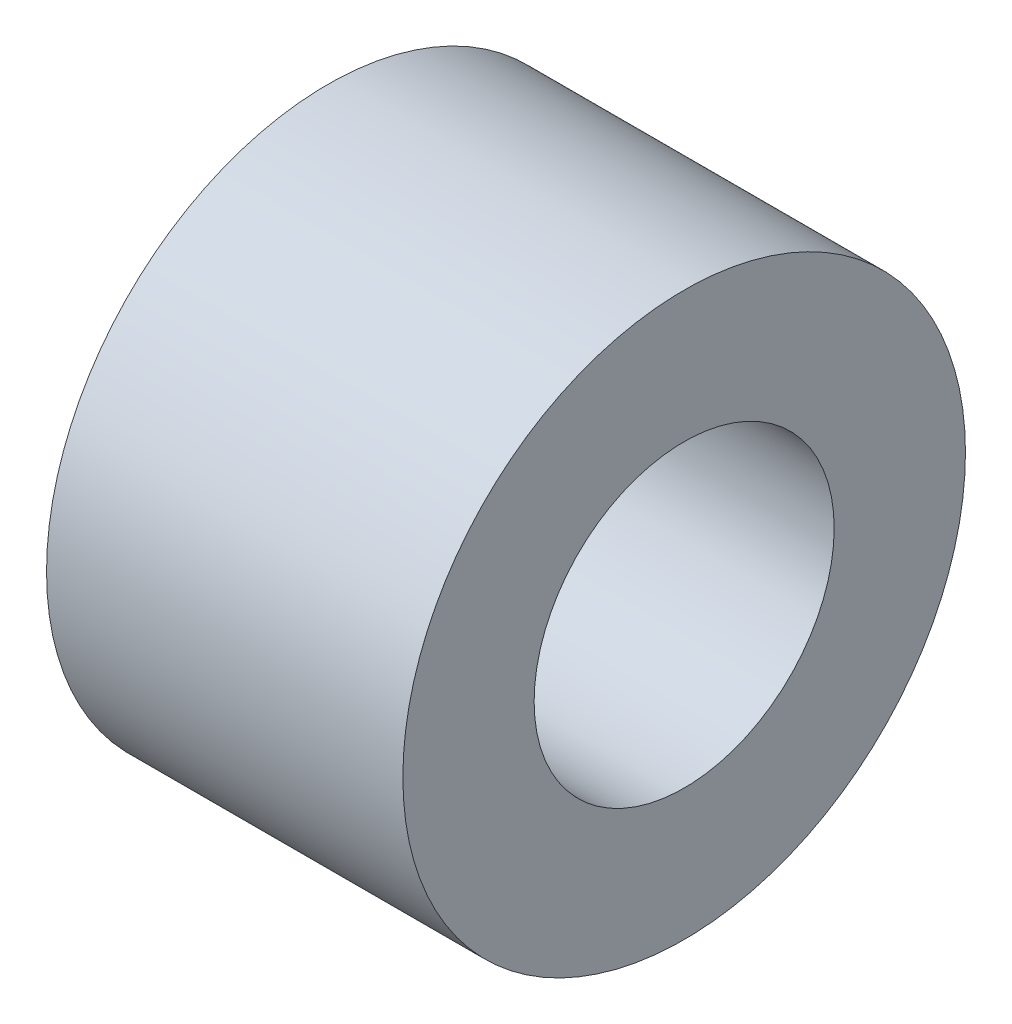
from build123d import *

# Parameters (mm, degrees)
SKETCH1_R           = 3
SKETCH1_R_2         = 1.6
BOSS_EXTRUDE1_DEPTH = 3.8


with BuildPart() as part:
    # Sketch1 → Boss-Extrude1 (new body)
    with BuildSketch(Plane(origin=(0, 0, 0), x_dir=(0, 0, -1), z_dir=(1, 0, 0))):
        with Locations(Location((0, 0, 0), (0, 0, 180))):
            Circle(SKETCH1_R)
        with Locations(Location((0, 0, 0), (0, 0, 180))):
            Circle(SKETCH1_R_2, mode=Mode.SUBTRACT)
    extrude(amount=BOSS_EXTRUDE1_DEPTH)


solid = part.part
